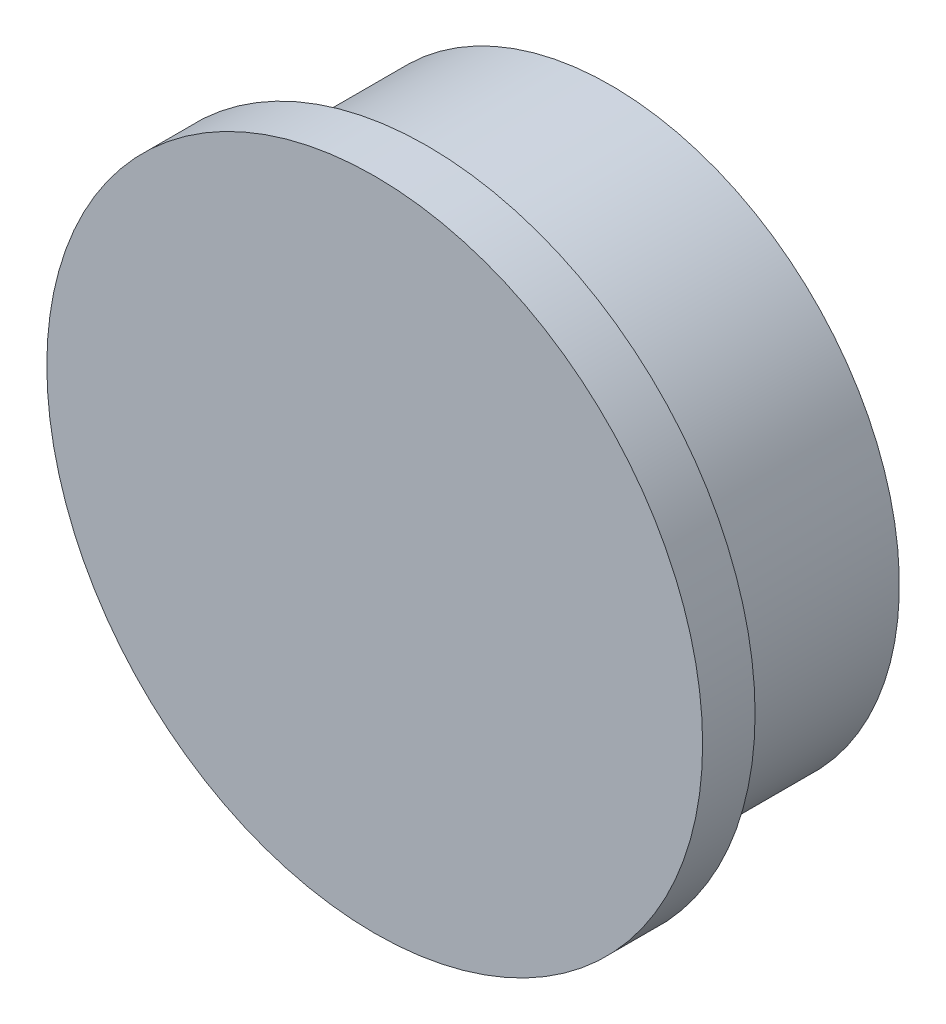
from build123d import *

# Parameters (mm, degrees)
CROQUIS1_R              = 12.5
SALIENTE_EXTRUIR1_DEPTH = 2
CROQUIS2_R              = 11
SALIENTE_EXTRUIR2_DEPTH = 7


with BuildPart() as part:
    # Croquis1 → Saliente-Extruir1 (new body)
    with BuildSketch(Plane.XY):
        Circle(CROQUIS1_R)
    extrude(amount=SALIENTE_EXTRUIR1_DEPTH)

    # Croquis2 → Saliente-Extruir2 (add)
    with BuildSketch(Plane(origin=(0, 0, 0), x_dir=(-1, 0, 0), z_dir=(0, 0, -1))):
        Circle(CROQUIS2_R)
    extrude(amount=SALIENTE_EXTRUIR2_DEPTH)


solid = part.part
